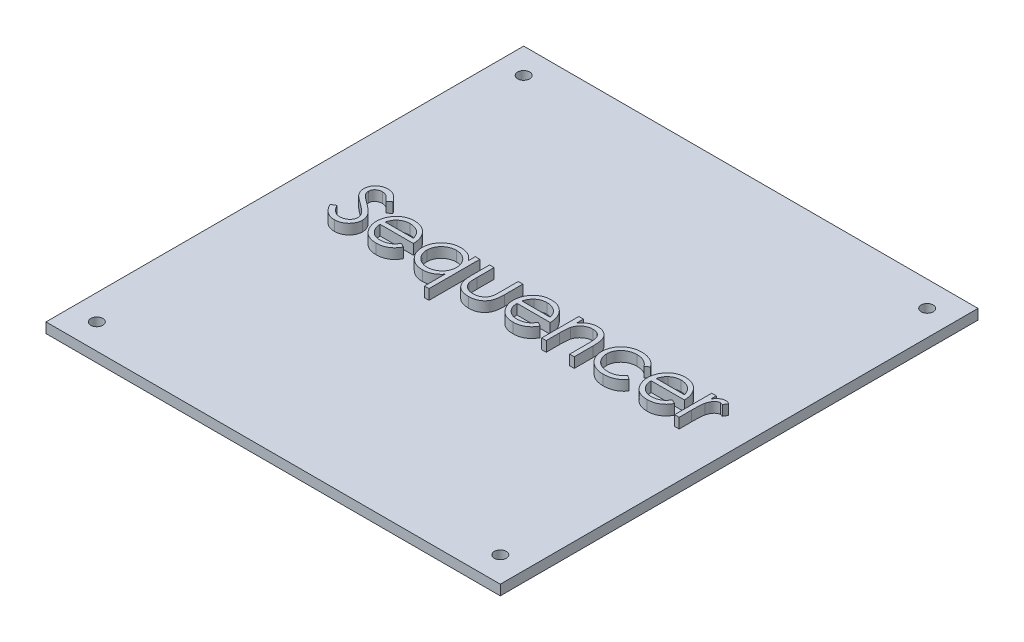
from build123d import *

# Parameters (mm, degrees)
SKETCH1_W             = 113.538
SKETCH1_H             = 119.38
BOSS_EXTRUDE1_DEPTH   = 2.54
BOSS_EXTRUDE2_DEPTH   = 2.54
F_3_0MM_DOWEL_HOLE1_D = 3


with BuildPart() as part:
    # Sketch1 → Boss-Extrude1 (new body)
    with BuildSketch(Plane(origin=(0, 0, 0), x_dir=(1, 0, 0), z_dir=(0, 1, 0))):
        Rectangle(SKETCH1_W, SKETCH1_H)
    extrude(amount=BOSS_EXTRUDE1_DEPTH)

    # Sketch2 → Boss-Extrude2 (add)
    # profile 1 of 9: a face of its own
    with BuildSketch(Plane(origin=(0, 2.54, 0), x_dir=(1, 0, 0), z_dir=(0, 1, 0))):
        with BuildLine():
            Line((-44.178603437, -1.309750689), (-43.105005681, -0.66610085))
            add(Edge.make_bspline(
                [(-43.105005681, -0.66610085), (-43.005153791, -0.833248761), (-42.813841425, -1.153497708), (-42.494703636, -1.586234026), (-42.164021358, -1.954033852), (-41.819345776, -2.254757542), (-41.462780765, -2.491517788), (-41.091998627, -2.659165886), (-40.708248856, -2.763726711), (-40.447086704, -2.776427025), (-40.316704399, -2.782767516)],
                knots=[0, 0, 0, 0, 1.272034388, 2.437168799, 3.508375237, 4.49857839, 5.41946034, 6.295179144, 7.148887113, 8, 8, 8, 8], degree=3))
            add(Edge.make_bspline(
                [(-40.316704399, -2.782767516), (-40.205354934, -2.779666276), (-39.984604357, -2.77351806), (-39.659621361, -2.714442007), (-39.344001679, -2.62368371), (-39.044250336, -2.493704902), (-38.764503392, -2.336448111), (-38.519187669, -2.146506267), (-38.307111772, -1.933849463), (-38.133632985, -1.69660383), (-38.000536857, -1.441453034), (-37.898239923, -1.179557439), (-37.841470656, -0.90680292), (-37.832919008, -0.723159241), (-37.828603437, -0.630483862)],
                knots=[0, 0, 0, 0, 1.095163259, 2.171163733, 3.241058638, 4.321873601, 5.38011039, 6.391990106, 7.366004449, 8.327778327, 9.272591725, 10.192022065, 11.087607919, 12, 12, 12, 12], degree=3))
            add(Edge.make_bspline(
                [(-37.828603437, -0.630483862), (-37.833953079, -0.524744208), (-37.844828119, -0.309790941), (-37.936745204, 0.007344942), (-38.081341042, 0.321189411), (-38.214736921, 0.515322574), (-38.283992059, 0.616110689)],
                knots=[0, 0, 0, 0, 0.938893495, 1.908633276, 2.914225137, 4, 4, 4, 4], degree=3))
            add(Edge.make_bspline(
                [(-38.283992059, 0.616110689), (-38.340854002, 0.68885202), (-38.460228538, 0.841563347), (-38.665451513, 1.068876058), (-38.906265699, 1.303348607), (-39.174430027, 1.553934328), (-39.479712949, 1.808978619), (-39.812552787, 2.080643513), (-40.181447361, 2.358597807), (-40.440162677, 2.54500683), (-40.573655521, 2.641190817)],
                knots=[0, 0, 0, 0, 0.722233717, 1.516239348, 2.393582979, 3.351407094, 4.387010283, 5.505090956, 6.712668013, 8, 8, 8, 8], degree=3))
            add(Edge.make_bspline(
                [(-40.573655521, 2.641190817), (-40.707274021, 2.736363121), (-40.962742419, 2.918325318), (-41.320006418, 3.188379149), (-41.639482041, 3.43528119), (-41.919749329, 3.661355748), (-42.160685009, 3.866633485), (-42.364187672, 4.04914315), (-42.525073293, 4.213820642), (-42.614537829, 4.320650654), (-42.6547052, 4.368614695)],
                knots=[0, 0, 0, 0, 1.452282411, 2.77665338, 3.964542531, 5.026858415, 5.96415736, 6.766646006, 7.446254459, 8, 8, 8, 8], degree=3))
            add(Edge.make_bspline(
                [(-42.6547052, 4.368614695), (-42.710848436, 4.443367029), (-42.821261643, 4.590377526), (-42.967006863, 4.820156295), (-43.090883254, 5.055372144), (-43.187992287, 5.296657138), (-43.269766567, 5.54062388), (-43.324768202, 5.790455543), (-43.359208413, 6.045031102), (-43.362735336, 6.216348661), (-43.364500873, 6.302108285)],
                knots=[0, 0, 0, 0, 1.068054152, 2.10047183, 3.106115577, 4.101338837, 5.06977816, 6.043150881, 7.020423561, 8, 8, 8, 8], degree=3))
            add(Edge.make_bspline(
                [(-43.364500873, 6.302108285), (-43.359764829, 6.436473467), (-43.350393971, 6.70233187), (-43.271144094, 7.090700883), (-43.146056737, 7.461491597), (-42.970815286, 7.811033094), (-42.744910034, 8.130223939), (-42.48348607, 8.422735734), (-42.172112963, 8.668638875), (-41.830473444, 8.883494059), (-41.456526037, 9.051663559), (-41.064673331, 9.178521972), (-40.654292526, 9.250401279), (-40.376332581, 9.260716454), (-40.235294142, 9.265950433)],
                knots=[0, 0, 0, 0, 1.005424448, 1.989358655, 2.955360095, 3.929531133, 4.905563448, 5.876582895, 6.856512386, 7.866279853, 8.892233794, 9.918561126, 10.94386622, 12, 12, 12, 12], degree=3))
            add(Edge.make_bspline(
                [(-40.235294142, 9.265950433), (-40.085636978, 9.260788602), (-39.788016645, 9.25052337), (-39.350232349, 9.16126947), (-38.928734892, 9.013584176), (-38.589669331, 8.845985331), (-38.324301882, 8.678594194), (-38.121926538, 8.52612226), (-37.916848931, 8.350589723), (-37.707414846, 8.15152903), (-37.497173025, 7.927113676), (-37.283002212, 7.678880605), (-37.06440158, 7.408346817), (-36.923773173, 7.215217914), (-36.85168036, 7.116210849)],
                knots=[0, 0, 0, 0, 1.286793592, 2.559021753, 3.825965368, 5.121522368, 5.803751409, 6.523245864, 7.299691795, 8.125521123, 9.008227632, 9.944561021, 10.946284179, 12, 12, 12, 12], degree=3))
            Line((-36.85168036, 7.116210849), (-37.882028918, 6.335181202))
            add(Edge.make_bspline(
                [(-37.882028918, 6.335181202), (-37.944244159, 6.415331593), (-38.064056166, 6.569682506), (-38.24595459, 6.78584128), (-38.417399683, 6.983295362), (-38.586311134, 7.154800256), (-38.743768025, 7.309747997), (-38.896592722, 7.442407686), (-39.042585939, 7.554079132), (-39.226615872, 7.673254335), (-39.457820164, 7.791387934), (-39.748049767, 7.891351731), (-40.051348536, 7.951422956), (-40.257921771, 7.959365491), (-40.362497668, 7.96338633)],
                knots=[0, 0, 0, 0, 1.181633172, 2.275549214, 3.290209073, 4.226197932, 5.078386478, 5.862611352, 6.581680152, 7.217281963, 8.414376989, 9.595101626, 10.782541182, 12, 12, 12, 12], degree=3))
            add(Edge.make_bspline(
                [(-40.362497668, 7.96338633), (-40.493694192, 7.95898959), (-40.74669433, 7.950510892), (-41.105887472, 7.857909802), (-41.429171143, 7.712107052), (-41.706947594, 7.507764131), (-41.938221768, 7.265662244), (-42.105518718, 6.987064684), (-42.206212172, 6.67942568), (-42.21849953, 6.464825956), (-42.224757283, 6.355533766)],
                knots=[0, 0, 0, 0, 1.14458467, 2.207223713, 3.21896685, 4.227309161, 5.202851033, 6.127160689, 7.046193047, 8, 8, 8, 8], degree=3))
            add(Edge.make_bspline(
                [(-42.224757283, 6.355533766), (-42.223330795, 6.287492687), (-42.220475487, 6.151299267), (-42.180652649, 5.950089822), (-42.129492227, 5.749388676), (-42.048420392, 5.550098161), (-41.936496004, 5.348732916), (-41.78952008, 5.141825468), (-41.604414634, 4.927552125), (-41.462620903, 4.788188226), (-41.387758085, 4.714608285)],
                knots=[0, 0, 0, 0, 0.858281714, 1.717966888, 2.583508476, 3.4729293, 4.427298488, 5.488583878, 6.674047936, 8, 8, 8, 8], degree=3))
            add(Edge.make_bspline(
                [(-41.387758085, 4.714608285), (-41.359958248, 4.689799649), (-41.293912198, 4.630860007), (-41.173168125, 4.534368017), (-41.013718543, 4.415340815), (-40.819727127, 4.268066838), (-40.587616986, 4.09722839), (-40.317362597, 3.905009854), (-40.011976463, 3.685171189), (-39.795271225, 3.531473827), (-39.680686771, 3.45020524)],
                knots=[0, 0, 0, 0, 0.420754252, 0.999615792, 1.744751191, 2.668019286, 3.750313428, 4.999500688, 6.413464383, 8, 8, 8, 8], degree=3))
            add(Edge.make_bspline(
                [(-39.680686771, 3.45020524), (-39.542852171, 3.349906593), (-39.275954572, 3.155692163), (-38.896197068, 2.863898124), (-38.551868107, 2.578519078), (-38.241758768, 2.301377475), (-37.962805415, 2.034575538), (-37.718102828, 1.774903426), (-37.505157645, 1.524221491), (-37.275907338, 1.202829573), (-37.041654679, 0.808109639), (-36.840481209, 0.324500031), (-36.713632348, -0.160989475), (-36.697044278, -0.487295425), (-36.688859848, -0.648292356)],
                knots=[0, 0, 0, 0, 1.163667725, 2.253281268, 3.268753668, 4.215851969, 5.092017293, 5.902905408, 6.650798638, 7.335211899, 8.59617414, 9.77448103, 10.901945474, 12, 12, 12, 12], degree=3))
            add(Edge.make_bspline(
                [(-36.688859848, -0.648292356), (-36.69124432, -0.762150995), (-36.695966961, -0.987657215), (-36.750253705, -1.31878278), (-36.829790776, -1.640386221), (-36.949668739, -1.948492258), (-37.095984199, -2.24873754), (-37.281644584, -2.533246207), (-37.496846754, -2.808315139), (-37.74371213, -3.066609522), (-38.013844404, -3.303722862), (-38.29935381, -3.514648313), (-38.600707658, -3.690519087), (-38.91627115, -3.834032142), (-39.246116771, -3.94627662), (-39.590133587, -4.027603317), (-39.948888671, -4.077516896), (-40.192730418, -4.082697631), (-40.316704399, -4.085331619)],
                knots=[0, 0, 0, 0, 0.983748083, 1.948392443, 2.894712957, 3.844097841, 4.80183111, 5.778335162, 6.776009319, 7.81870978, 8.863265674, 9.881300176, 10.883814829, 11.87499822, 12.874611388, 13.892143829, 14.928324115, 16, 16, 16, 16], degree=3))
            add(Edge.make_bspline(
                [(-40.316704399, -4.085331619), (-40.412626929, -4.08347676), (-40.603263944, -4.079790402), (-40.88523835, -4.047201184), (-41.161516288, -4.001092551), (-41.428630968, -3.927889498), (-41.690023862, -3.839073038), (-41.944558113, -3.729713945), (-42.19235708, -3.5986601), (-42.434809452, -3.448818154), (-42.6712986, -3.274437195), (-42.899606383, -3.071333365), (-43.127223714, -2.845108247), (-43.347432266, -2.589618488), (-43.564686247, -2.30899173), (-43.77470219, -2.000602408), (-43.98182728, -1.666130296), (-44.111786263, -1.430762699), (-44.178603437, -1.309750689)],
                knots=[0, 0, 0, 0, 0.915332311, 1.819136955, 2.706846663, 3.586547465, 4.459518054, 5.340707479, 6.227863349, 7.133153174, 8.059268498, 9.028702269, 10.047606654, 11.120612155, 12.245963614, 13.433783089, 14.680604001, 16, 16, 16, 16], degree=3))
        make_face()
    # profile 2 of 9: a face of its own
    with BuildSketch(Plane(origin=(0, 2.54, 0), x_dir=(1, 0, 0), z_dir=(0, 1, 0))):
        with BuildLine():
            Line((-26.792425553, -0.828921362), (-25.779885489, -1.3606321))
            add(Edge.make_bspline(
                [(-25.779885489, -1.3606321), (-25.860572563, -1.503755044), (-26.017557656, -1.782215618), (-26.287526084, -2.164782654), (-26.570525891, -2.508944366), (-26.879331717, -2.805506254), (-27.204704552, -3.064046994), (-27.548448757, -3.290244244), (-27.912353896, -3.482988589), (-28.296437183, -3.645376333), (-28.703924125, -3.77023364), (-29.135802199, -3.858423242), (-29.592898768, -3.912936245), (-29.906212049, -3.919268613), (-30.066644303, -3.922511106)],
                knots=[0, 0, 0, 0, 1.120438281, 2.179929193, 3.190490725, 4.156257408, 5.095198341, 6.022838206, 6.959905092, 7.901321166, 8.864066838, 9.862729781, 10.905609505, 12, 12, 12, 12], degree=3))
            add(Edge.make_bspline(
                [(-30.066644303, -3.922511106), (-30.244959478, -3.918348498), (-30.592800728, -3.910228457), (-31.099130667, -3.840224372), (-31.575850271, -3.72602467), (-32.022932738, -3.566492562), (-32.439283197, -3.358113415), (-32.825729156, -3.104260438), (-33.184302864, -2.806237685), (-33.503704995, -2.461463733), (-33.791247083, -2.092503488), (-34.044977916, -1.708034993), (-34.25709488, -1.309025579), (-34.429642922, -0.898015391), (-34.568997718, -0.477594978), (-34.666122615, -0.043939081), (-34.722110557, 0.40177861), (-34.730690117, 0.703303229), (-34.735013694, 0.855253317)],
                knots=[0, 0, 0, 0, 1.145258523, 2.234067595, 3.276747158, 4.290159414, 5.277019952, 6.260822364, 7.254936242, 8.264827045, 9.274100331, 10.257902744, 11.220704747, 12.172965371, 13.118907548, 14.062713208, 15.023725156, 16, 16, 16, 16], degree=3))
            add(Edge.make_bspline(
                [(-34.735013694, 0.855253317), (-34.731170524, 0.997837416), (-34.723553868, 1.280420271), (-34.675545011, 1.698669532), (-34.590461205, 2.105172774), (-34.473707115, 2.500267771), (-34.322935451, 2.883293), (-34.138487112, 3.254481574), (-33.92007477, 3.61343851), (-33.751445354, 3.839872738), (-33.666504078, 3.953931202)],
                knots=[0, 0, 0, 0, 1.024358464, 2.0301432, 3.019427413, 4.004406732, 4.986367066, 5.972626655, 6.978780325, 8, 8, 8, 8], degree=3))
            add(Edge.make_bspline(
                [(-33.666504078, 3.953931202), (-33.551450487, 4.091341102), (-33.324987909, 4.361808105), (-32.941969134, 4.717184316), (-32.527222707, 5.014886014), (-32.085946235, 5.261654765), (-31.613011029, 5.449156284), (-31.114774459, 5.588883797), (-30.585563332, 5.667181151), (-30.223775816, 5.678240433), (-30.038659527, 5.68389915)],
                knots=[0, 0, 0, 0, 1.030682036, 2.02871468, 2.997146059, 3.962720338, 4.930598197, 5.918074684, 6.934738563, 8, 8, 8, 8], degree=3))
            add(Edge.make_bspline(
                [(-30.038659527, 5.68389915), (-29.848349645, 5.678985887), (-29.475005038, 5.669347185), (-28.93060277, 5.579988775), (-28.41548817, 5.438283792), (-27.929867369, 5.238154323), (-27.473691132, 4.979946807), (-27.049924609, 4.660117839), (-26.651320549, 4.288486494), (-26.419423706, 4.002688563), (-26.301419944, 3.857256522)],
                knots=[0, 0, 0, 0, 1.056321875, 2.072262726, 3.055038591, 4.01806755, 4.982017516, 5.957941055, 6.960871419, 8, 8, 8, 8], degree=3))
            add(Edge.make_bspline(
                [(-26.301419944, 3.857256522), (-26.221130768, 3.74766067), (-26.061086844, 3.529198468), (-25.860618795, 3.172977412), (-25.686601962, 2.800284684), (-25.547508075, 2.405095892), (-25.434879028, 1.992093415), (-25.353392857, 1.558324753), (-25.305605955, 1.103919074), (-25.296212682, 0.794305573), (-25.29142395, 0.636463253)],
                knots=[0, 0, 0, 0, 0.94817472, 1.890038105, 2.849395472, 3.817997239, 4.812318967, 5.836947057, 6.897266129, 8, 8, 8, 8], degree=3))
            Line((-25.29142395, 0.636463253), (-33.595270104, 0.636463253))
            add(Edge.make_bspline(
                [(-33.595270104, 0.636463253), (-33.589683532, 0.514178711), (-33.578697764, 0.273711092), (-33.527479959, -0.078154321), (-33.446748694, -0.413337591), (-33.333286666, -0.729324629), (-33.195884114, -1.03024252), (-33.027570227, -1.313859054), (-32.826766703, -1.578882401), (-32.602790593, -1.827683157), (-32.35348199, -2.04924649), (-32.091198879, -2.247554364), (-31.812185086, -2.413763244), (-31.518640612, -2.548673129), (-31.211040134, -2.654287476), (-30.88928674, -2.726379283), (-30.554013575, -2.774665071), (-30.32546534, -2.780034141), (-30.209112251, -2.782767516)],
                knots=[0, 0, 0, 0, 1.094153842, 2.151609401, 3.174256925, 4.172055639, 5.149267565, 6.128595816, 7.11444997, 8.118368179, 9.117203808, 10.09244225, 11.054858984, 12.015122123, 12.976791628, 13.957293641, 14.960065497, 16, 16, 16, 16], degree=3))
            add(Edge.make_bspline(
                [(-30.209112251, -2.782767516), (-30.095352373, -2.780561139), (-29.869630952, -2.776183264), (-29.533476984, -2.733613187), (-29.202770698, -2.664778187), (-28.878880845, -2.570834509), (-28.568380918, -2.456255645), (-28.280832779, -2.317996705), (-28.016381711, -2.165053338), (-27.769214433, -1.990121089), (-27.529471114, -1.776005667), (-27.29164552, -1.508813194), (-27.036641664, -1.192809879), (-26.877022284, -0.954972748), (-26.792425553, -0.828921362)],
                knots=[0, 0, 0, 0, 0.99110716, 1.966546729, 2.947904876, 3.932708344, 4.903319531, 5.828989031, 6.710028674, 7.56322171, 8.463672341, 9.504779593, 10.677557249, 12, 12, 12, 12], degree=3))
        make_face()
        with BuildLine():
            add(Edge.make_bspline(
                [(-26.43116754, 1.776206843), (-26.472883863, 1.927383556), (-26.553174357, 2.218350065), (-26.720946308, 2.621269867), (-26.909891613, 2.979365965), (-27.133490467, 3.289897777), (-27.3868327, 3.565681952), (-27.679459505, 3.806686533), (-28.007612605, 4.022286998), (-28.369595772, 4.204268925), (-28.752924535, 4.359172126), (-29.154267003, 4.463040404), (-29.563779548, 4.534195029), (-29.840763958, 4.540821193), (-29.980145905, 4.544155561)],
                knots=[0, 0, 0, 0, 1.154881502, 2.222775134, 3.210006277, 4.132804581, 5.035138423, 5.962687519, 6.919655026, 7.923214229, 8.944639381, 9.960483929, 10.97369054, 12, 12, 12, 12], degree=3))
            add(Edge.make_bspline(
                [(-29.980145905, 4.544155561), (-30.093899582, 4.541936067), (-30.318766686, 4.537548594), (-30.650059133, 4.49592841), (-30.968211184, 4.427131259), (-31.27557037, 4.332915559), (-31.56810895, 4.207335773), (-31.851844251, 4.060076637), (-32.119561689, 3.880311461), (-32.286988676, 3.743300759), (-32.371572187, 3.674083445)],
                knots=[0, 0, 0, 0, 1.04873581, 2.073130211, 3.073294108, 4.04793562, 5.032784715, 6.005352987, 6.992311501, 8, 8, 8, 8], degree=3))
            add(Edge.make_bspline(
                [(-32.371572187, 3.674083445), (-32.432144953, 3.619312643), (-32.554729469, 3.508469888), (-32.718525075, 3.317501052), (-32.875353648, 3.111573955), (-33.018078616, 2.882810218), (-33.148988716, 2.633814819), (-33.271489204, 2.366687972), (-33.381748471, 2.079402613), (-33.443782928, 1.879205477), (-33.47569879, 1.776206843)],
                knots=[0, 0, 0, 0, 0.879870761, 1.780643979, 2.707998968, 3.669668524, 4.684282772, 5.740141944, 6.837334558, 8, 8, 8, 8], degree=3))
            Line((-33.47569879, 1.776206843), (-26.43116754, 1.776206843))
        make_face(mode=Mode.SUBTRACT)
    # profile 3 of 9: a face of its own
    with BuildSketch(Plane(origin=(0, 2.54, 0), x_dir=(1, 0, 0), z_dir=(0, 1, 0))):
        with BuildLine():
            Line((-13.568347027, 5.521078638), (-13.568347027, -7.178921362))
            Line((-13.568347027, -7.178921362), (-14.708090617, -7.178921362))
            Line((-14.708090617, -7.178921362), (-14.708090617, -2.078059984))
            add(Edge.make_bspline(
                [(-14.708090617, -2.078059984), (-14.8367963, -2.223998468), (-15.08869527, -2.509624966), (-15.507323907, -2.887075713), (-15.950292386, -3.206036616), (-16.417264266, -3.467597609), (-16.904679265, -3.674001887), (-17.417363012, -3.814460012), (-17.950015143, -3.908537958), (-18.314323255, -3.917814712), (-18.498755681, -3.922511106)],
                knots=[0, 0, 0, 0, 1.069893489, 2.093963999, 3.093541679, 4.066938296, 5.033073547, 5.99758523, 6.986269586, 8, 8, 8, 8], degree=3))
            add(Edge.make_bspline(
                [(-18.498755681, -3.922511106), (-18.662650828, -3.918061127), (-18.985859314, -3.90928557), (-19.46130768, -3.841205211), (-19.918842413, -3.731874099), (-20.358895863, -3.579833728), (-20.778620505, -3.378154747), (-21.181609998, -3.136705075), (-21.565776624, -2.849174063), (-21.925264779, -2.520468932), (-22.256306609, -2.163435693), (-22.546814656, -1.78263328), (-22.789032974, -1.379708348), (-22.991580124, -0.959762333), (-23.147595431, -0.519562482), (-23.256356904, -0.060631044), (-23.324357953, 0.416489354), (-23.333129882, 0.741389909), (-23.337577796, 0.906134727)],
                knots=[0, 0, 0, 0, 1.033919861, 2.038935746, 3.024066025, 3.998881131, 4.97069526, 5.957263378, 6.95902576, 7.993208707, 9.027059324, 10.027763471, 11.009749337, 11.988697705, 12.965288445, 13.950418724, 14.960734635, 16, 16, 16, 16], degree=3))
            add(Edge.make_bspline(
                [(-23.337577796, 0.906134727), (-23.3330313, 1.067474452), (-23.324043122, 1.386434383), (-23.257084296, 1.855531373), (-23.144486065, 2.307354776), (-22.986469589, 2.74044997), (-22.783843067, 3.155341009), (-22.537361151, 3.552321329), (-22.247006041, 3.932484571), (-21.912261593, 4.286891594), (-21.549641141, 4.614263537), (-21.161715175, 4.898776359), (-20.758133554, 5.144491782), (-20.332636344, 5.339177253), (-19.891521421, 5.49669029), (-19.430861775, 5.60566706), (-18.952574047, 5.669883054), (-18.627851404, 5.679182227), (-18.463138694, 5.68389915)],
                knots=[0, 0, 0, 0, 1.020392517, 2.01726096, 2.990465484, 3.961182959, 4.928053699, 5.906110375, 6.912531644, 7.948652711, 8.985773172, 9.998621852, 10.987621588, 11.969261332, 12.953316658, 13.946091881, 14.958173133, 16, 16, 16, 16], degree=3))
            add(Edge.make_bspline(
                [(-18.463138694, 5.68389915), (-18.273727777, 5.678682166), (-17.902301907, 5.668451907), (-17.359003131, 5.583315725), (-16.845036025, 5.439484715), (-16.356433091, 5.243841222), (-15.894948887, 4.983858691), (-15.464952344, 4.655908547), (-15.061943305, 4.262059097), (-14.828334818, 3.959543484), (-14.708090617, 3.803831041)],
                knots=[0, 0, 0, 0, 1.038897134, 2.037228247, 3.008116434, 3.962042015, 4.918381754, 5.904844433, 6.921570401, 8, 8, 8, 8], degree=3))
            Line((-14.708090617, 3.803831041), (-14.708090617, 5.521078638))
            Line((-14.708090617, 5.521078638), (-13.568347027, 5.521078638))
        make_face()
        with BuildLine():
            add(Edge.make_bspline(
                [(-18.447874271, 4.544155561), (-18.614477725, 4.53822779), (-18.943326445, 4.526527312), (-19.42608611, 4.435183487), (-19.888051927, 4.283202244), (-20.326913396, 4.075350774), (-20.735738068, 3.813989359), (-21.101112245, 3.497863196), (-21.426024333, 3.135597459), (-21.699285749, 2.728826944), (-21.922045552, 2.292752157), (-22.07868021, 1.83691491), (-22.181982908, 1.369536849), (-22.192536683, 1.052535103), (-22.197834207, 0.893414375)],
                knots=[0, 0, 0, 0, 1.031046209, 2.035121221, 3.029706178, 4.034933723, 5.034054252, 6.02443088, 7.017295772, 8.038157696, 9.050218397, 10.03989886, 11.016116709, 12, 12, 12, 12], degree=3))
            add(Edge.make_bspline(
                [(-22.197834207, 0.893414375), (-22.191067308, 0.735244557), (-22.177560035, 0.419524895), (-22.080493229, -0.048490341), (-21.917643403, -0.504435008), (-21.695422204, -0.944439184), (-21.417159308, -1.352958634), (-21.094620483, -1.722129936), (-20.724686606, -2.039592157), (-20.31492108, -2.305339924), (-19.877286444, -2.520015357), (-19.417060464, -2.66938782), (-18.942894577, -2.765827195), (-18.620487537, -2.777092011), (-18.458050553, -2.782767516)],
                knots=[0, 0, 0, 0, 0.979072187, 1.954306742, 2.945804271, 3.96968567, 4.997920485, 5.998718438, 6.996577872, 8.005894225, 9.015743152, 10.005417472, 10.995077863, 12, 12, 12, 12], degree=3))
            add(Edge.make_bspline(
                [(-18.458050553, -2.782767516), (-18.293144671, -2.776744219), (-17.965163229, -2.764764477), (-17.480971346, -2.6730296), (-17.011089624, -2.521468532), (-16.561918824, -2.311377415), (-16.143486005, -2.051000723), (-15.767936563, -1.746174993), (-15.450378621, -1.391652011), (-15.181165437, -1.002028881), (-14.970071783, -0.574902494), (-14.816307225, -0.12011843), (-14.725397338, 0.362339142), (-14.713939291, 0.692045391), (-14.708090617, 0.860341458)],
                knots=[0, 0, 0, 0, 1.01762866, 2.023962475, 3.030623092, 4.058876274, 5.077231937, 6.066672613, 7.034107872, 8.005628644, 8.981990164, 9.965428785, 10.961468474, 12, 12, 12, 12], degree=3))
            add(Edge.make_bspline(
                [(-14.708090617, 0.860341458), (-14.711572798, 0.9885673), (-14.718426834, 1.240956336), (-14.770789186, 1.611533328), (-14.854082776, 1.966167134), (-14.971453165, 2.305230605), (-15.125635825, 2.62684909), (-15.311592004, 2.933331877), (-15.532591779, 3.223084958), (-15.785077562, 3.492118387), (-16.06144844, 3.737505836), (-16.353891487, 3.956541795), (-16.665871512, 4.136478199), (-16.992141903, 4.285399384), (-17.333268745, 4.403905443), (-17.692027852, 4.482963646), (-18.06460589, 4.537248239), (-18.318773005, 4.541828878), (-18.447874271, 4.544155561)],
                knots=[0, 0, 0, 0, 1.050140795, 2.067009409, 3.05949893, 4.030605086, 5.00011959, 5.97591094, 6.962425594, 7.979863591, 8.993523472, 9.986985069, 10.967611495, 11.937549037, 12.921786183, 13.919465291, 14.943216303, 16, 16, 16, 16], degree=3))
        make_face(mode=Mode.SUBTRACT)
    # profile 4 of 9: a face of its own
    with BuildSketch(Plane(origin=(0, 2.54, 0), x_dir=(1, 0, 0), z_dir=(0, 1, 0))):
        with BuildLine():
            Line((-11.126039335, 5.521078638), (-9.986295745, 5.521078638))
            Line((-9.986295745, 5.521078638), (-9.986295745, 1.21651133))
            add(Edge.make_bspline(
                [(-9.986295745, 1.21651133), (-9.985780833, 1.090154497), (-9.98479583, 0.848439795), (-9.978115845, 0.500622403), (-9.962403791, 0.183424617), (-9.942759342, -0.103336799), (-9.917496733, -0.359613334), (-9.887439968, -0.584509858), (-9.853845124, -0.780576755), (-9.820960419, -0.898662646), (-9.805666739, -0.953580817)],
                knots=[0, 0, 0, 0, 1.388932606, 2.656963016, 3.823490214, 4.879454478, 5.816252168, 6.653371382, 7.373723809, 8, 8, 8, 8], degree=3))
            add(Edge.make_bspline(
                [(-9.805666739, -0.953580817), (-9.781132316, -1.022606664), (-9.732573536, -1.159223325), (-9.644495466, -1.356577716), (-9.535535502, -1.539368026), (-9.41630127, -1.714642804), (-9.278780562, -1.877210014), (-9.124713338, -2.026795126), (-8.959256878, -2.169049972), (-8.713402936, -2.337360503), (-8.377182171, -2.517756129), (-7.935756459, -2.67340667), (-7.457132553, -2.766428074), (-7.126334858, -2.777220371), (-6.956307764, -2.782767516)],
                knots=[0, 0, 0, 0, 0.725840625, 1.436591201, 2.137033971, 2.831655856, 3.53531722, 4.242432219, 4.957935707, 5.694543706, 7.190802206, 8.724350549, 10.316345118, 12, 12, 12, 12], degree=3))
            add(Edge.make_bspline(
                [(-6.956307764, -2.782767516), (-6.786296465, -2.777102414), (-6.457356057, -2.76614149), (-5.983990883, -2.67621265), (-5.551278608, -2.52596915), (-5.163562298, -2.316210827), (-4.822600536, -2.059518199), (-4.538467359, -1.758314807), (-4.304035321, -1.422129889), (-4.201675423, -1.171307506), (-4.150197989, -1.045167356)],
                knots=[0, 0, 0, 0, 1.157059328, 2.238695713, 3.266970494, 4.264342957, 5.228770407, 6.160125903, 7.074715775, 8, 8, 8, 8], degree=3))
            add(Edge.make_bspline(
                [(-4.150197989, -1.045167356), (-4.134978925, -0.994489644), (-4.101333293, -0.882453599), (-4.065184189, -0.69238994), (-4.032619714, -0.465732661), (-4.004813332, -0.200998589), (-3.984982599, 0.10112045), (-3.974292731, 0.44053004), (-3.962215847, 0.81616469), (-3.962032545, 1.079119131), (-3.961936771, 1.21651133)],
                knots=[0, 0, 0, 0, 0.557542046, 1.232589297, 2.036731608, 2.971723315, 4.038036528, 5.22795436, 6.551621927, 8, 8, 8, 8], degree=3))
            Line((-3.961936771, 1.21651133), (-3.961936771, 5.521078638))
            Line((-3.961936771, 5.521078638), (-2.822193181, 5.521078638))
            Line((-2.822193181, 5.521078638), (-2.822193181, 1.002809407))
            add(Edge.make_bspline(
                [(-2.822193181, 1.002809407), (-2.823795902, 0.849294813), (-2.8269054, 0.551455502), (-2.84688919, 0.118624583), (-2.881177784, -0.284735562), (-2.933221241, -0.658838446), (-2.994419546, -1.003398451), (-3.073363737, -1.318857183), (-3.167627628, -1.604242708), (-3.273964782, -1.86456287), (-3.399592701, -2.100590172), (-3.533222176, -2.324602992), (-3.687526348, -2.531043071), (-3.849978341, -2.730186826), (-4.030687207, -2.91212894), (-4.226266695, -3.081044295), (-4.433964018, -3.23951501), (-4.658388251, -3.38136051), (-4.896263108, -3.509146623), (-5.147882246, -3.622416392), (-5.416327582, -3.712051457), (-5.698135637, -3.78937873), (-5.994687093, -3.850028375), (-6.305696062, -3.892796775), (-6.631057784, -3.919014404), (-6.852797823, -3.921325967), (-6.966484046, -3.922511106)],
                knots=[0, 0, 0, 0, 1.493040784, 2.896703357, 4.213163133, 5.428574705, 6.569057535, 7.615249723, 8.588095153, 9.490268104, 10.346124644, 11.18633936, 12.024365274, 12.850166724, 13.684164916, 14.514361689, 15.362232829, 16.222528818, 17.093394965, 17.986930858, 18.902426812, 19.842810585, 20.827885679, 21.843828298, 22.894529745, 24, 24, 24, 24], degree=3))
            add(Edge.make_bspline(
                [(-6.966484046, -3.922511106), (-7.079319969, -3.921278454), (-7.301053061, -3.918856179), (-7.626431576, -3.89294162), (-7.938302233, -3.850094829), (-8.23555625, -3.788934469), (-8.518491921, -3.712592701), (-8.788255305, -3.621865586), (-9.041687663, -3.509087838), (-9.281833791, -3.382169273), (-9.506813886, -3.238603845), (-9.717665012, -3.081239815), (-9.914104448, -2.910312101), (-10.096175524, -2.726534548), (-10.26132261, -2.527627378), (-10.411603676, -2.315190631), (-10.549332292, -2.091329224), (-10.673983845, -1.85161432), (-10.781069358, -1.588281599), (-10.875612679, -1.296917847), (-10.952939852, -0.974328714), (-11.015868238, -0.620790002), (-11.066492036, -0.237993709), (-11.101638895, 0.176274541), (-11.121290624, 0.621005653), (-11.124422304, 0.928163825), (-11.126039335, 1.086763734)],
                knots=[0, 0, 0, 0, 1.083640291, 2.129454052, 3.13281866, 4.105697902, 5.042300162, 5.946461698, 6.836384745, 7.703652036, 8.553297018, 9.397182691, 10.228592656, 11.052265423, 11.879314572, 12.708807002, 13.549817954, 14.402308542, 15.300838682, 16.27712199, 17.341985831, 18.484375296, 19.725102775, 21.0496083, 22.476576903, 24, 24, 24, 24], degree=3))
            Line((-11.126039335, 1.086763734), (-11.126039335, 5.521078638))
        make_face()
    # profile 5 of 9: a face of its own
    with BuildSketch(Plane(origin=(0, 2.54, 0), x_dir=(1, 0, 0), z_dir=(0, 1, 0))):
        with BuildLine():
            Line((7.39988214, -0.828921362), (8.412422204, -1.3606321))
            add(Edge.make_bspline(
                [(8.412422204, -1.3606321), (8.33173513, -1.503755044), (8.174750036, -1.782215618), (7.904781608, -2.164782654), (7.621781802, -2.508944366), (7.312975975, -2.805506254), (6.98760314, -3.064046994), (6.643858935, -3.290244244), (6.279953797, -3.482988589), (5.89587051, -3.645376333), (5.488383567, -3.77023364), (5.056505493, -3.858423242), (4.599408924, -3.912936245), (4.286095643, -3.919268613), (4.12566339, -3.922511106)],
                knots=[0, 0, 0, 0, 1.120438281, 2.179929193, 3.190490725, 4.156257408, 5.095198341, 6.022838206, 6.959905092, 7.901321166, 8.864066838, 9.862729781, 10.905609505, 12, 12, 12, 12], degree=3))
            add(Edge.make_bspline(
                [(4.12566339, -3.922511106), (3.947348214, -3.918348498), (3.599506965, -3.910228457), (3.093177025, -3.840224372), (2.616457421, -3.72602467), (2.169374955, -3.566492562), (1.753024495, -3.358113415), (1.366578536, -3.104260438), (1.008004828, -2.806237685), (0.688602698, -2.461463733), (0.401060609, -2.092503488), (0.147329777, -1.708034993), (-0.064787187, -1.309025579), (-0.23733523, -0.898015391), (-0.376690026, -0.477594978), (-0.473814922, -0.043939081), (-0.529802865, 0.40177861), (-0.538382425, 0.703303229), (-0.542706001, 0.855253317)],
                knots=[0, 0, 0, 0, 1.145258523, 2.234067595, 3.276747158, 4.290159414, 5.277019952, 6.260822364, 7.254936242, 8.264827045, 9.274100331, 10.257902744, 11.220704747, 12.172965371, 13.118907548, 14.062713208, 15.023725156, 16, 16, 16, 16], degree=3))
            add(Edge.make_bspline(
                [(-0.542706001, 0.855253317), (-0.538862831, 0.997837416), (-0.531246176, 1.280420271), (-0.483237319, 1.698669532), (-0.398153513, 2.105172774), (-0.281399423, 2.500267771), (-0.130627758, 2.883293), (0.05382058, 3.254481574), (0.272232922, 3.61343851), (0.440862339, 3.839872738), (0.525803614, 3.953931202)],
                knots=[0, 0, 0, 0, 1.024358464, 2.0301432, 3.019427413, 4.004406732, 4.986367066, 5.972626655, 6.978780325, 8, 8, 8, 8], degree=3))
            add(Edge.make_bspline(
                [(0.525803614, 3.953931202), (0.640857206, 4.091341102), (0.867319783, 4.361808105), (1.250338559, 4.717184316), (1.665084985, 5.014886014), (2.106361457, 5.261654765), (2.579296663, 5.449156284), (3.077533233, 5.588883797), (3.606744361, 5.667181151), (3.968531876, 5.678240433), (4.153648165, 5.68389915)],
                knots=[0, 0, 0, 0, 1.030682036, 2.02871468, 2.997146059, 3.962720338, 4.930598197, 5.918074684, 6.934738563, 8, 8, 8, 8], degree=3))
            add(Edge.make_bspline(
                [(4.153648165, 5.68389915), (4.343958047, 5.678985887), (4.717302654, 5.669347185), (5.261704922, 5.579988775), (5.776819522, 5.438283792), (6.262440323, 5.238154323), (6.718616561, 4.979946807), (7.142383084, 4.660117839), (7.540987143, 4.288486494), (7.772883987, 4.002688563), (7.890887749, 3.857256522)],
                knots=[0, 0, 0, 0, 1.056321875, 2.072262726, 3.055038591, 4.01806755, 4.982017516, 5.957941055, 6.960871419, 8, 8, 8, 8], degree=3))
            add(Edge.make_bspline(
                [(7.890887749, 3.857256522), (7.971176925, 3.74766067), (8.131220848, 3.529198468), (8.331688897, 3.172977412), (8.50570573, 2.800284684), (8.644799617, 2.405095892), (8.757428665, 1.992093415), (8.838914835, 1.558324753), (8.886701737, 1.103919074), (8.89609501, 0.794305573), (8.900883742, 0.636463253)],
                knots=[0, 0, 0, 0, 0.94817472, 1.890038105, 2.849395472, 3.817997239, 4.812318967, 5.836947057, 6.897266129, 8, 8, 8, 8], degree=3))
            Line((8.900883742, 0.636463253), (0.597037588, 0.636463253))
            add(Edge.make_bspline(
                [(0.597037588, 0.636463253), (0.60262416, 0.514178711), (0.613609929, 0.273711092), (0.664827734, -0.078154321), (0.745558999, -0.413337591), (0.859021026, -0.729324629), (0.996423579, -1.03024252), (1.164737465, -1.313859054), (1.36554099, -1.578882401), (1.589517099, -1.827683157), (1.838825702, -2.04924649), (2.101108813, -2.247554364), (2.380122606, -2.413763244), (2.673667081, -2.548673129), (2.981267558, -2.654287476), (3.303020952, -2.726379283), (3.638294117, -2.774665071), (3.866842352, -2.780034141), (3.983195441, -2.782767516)],
                knots=[0, 0, 0, 0, 1.094153842, 2.151609401, 3.174256925, 4.172055639, 5.149267565, 6.128595816, 7.11444997, 8.118368179, 9.117203808, 10.09244225, 11.054858984, 12.015122123, 12.976791628, 13.957293641, 14.960065497, 16, 16, 16, 16], degree=3))
            add(Edge.make_bspline(
                [(3.983195441, -2.782767516), (4.096955319, -2.780561139), (4.322676741, -2.776183264), (4.658830709, -2.733613187), (4.989536994, -2.664778187), (5.313426847, -2.570834509), (5.623926774, -2.456255645), (5.911474913, -2.317996705), (6.175925981, -2.165053338), (6.42309326, -1.990121089), (6.662836579, -1.776005667), (6.900662172, -1.508813194), (7.155666029, -1.192809879), (7.315285408, -0.954972748), (7.39988214, -0.828921362)],
                knots=[0, 0, 0, 0, 0.99110716, 1.966546729, 2.947904876, 3.932708344, 4.903319531, 5.828989031, 6.710028674, 7.56322171, 8.463672341, 9.504779593, 10.677557249, 12, 12, 12, 12], degree=3))
        make_face()
        with BuildLine():
            add(Edge.make_bspline(
                [(7.761140152, 1.776206843), (7.719423829, 1.927383556), (7.639133335, 2.218350065), (7.471361384, 2.621269867), (7.282416079, 2.979365965), (7.058817225, 3.289897777), (6.805474992, 3.565681952), (6.512848187, 3.806686533), (6.184695088, 4.022286998), (5.82271192, 4.204268925), (5.439383157, 4.359172126), (5.038040689, 4.463040404), (4.628528144, 4.534195029), (4.351543734, 4.540821193), (4.212161787, 4.544155561)],
                knots=[0, 0, 0, 0, 1.154881502, 2.222775134, 3.210006277, 4.132804581, 5.035138423, 5.962687519, 6.919655026, 7.923214229, 8.944639381, 9.960483929, 10.97369054, 12, 12, 12, 12], degree=3))
            add(Edge.make_bspline(
                [(4.212161787, 4.544155561), (4.09840811, 4.541936067), (3.873541006, 4.537548594), (3.542248559, 4.49592841), (3.224096509, 4.427131259), (2.916737322, 4.332915559), (2.624198743, 4.207335773), (2.340463441, 4.060076637), (2.072746003, 3.880311461), (1.905319017, 3.743300759), (1.820735505, 3.674083445)],
                knots=[0, 0, 0, 0, 1.04873581, 2.073130211, 3.073294108, 4.04793562, 5.032784715, 6.005352987, 6.992311501, 8, 8, 8, 8], degree=3))
            add(Edge.make_bspline(
                [(1.820735505, 3.674083445), (1.760162739, 3.619312643), (1.637578223, 3.508469888), (1.473782617, 3.317501052), (1.316954045, 3.111573955), (1.174229076, 2.882810218), (1.043318977, 2.633814819), (0.920818488, 2.366687972), (0.810559221, 2.079402613), (0.748524765, 1.879205477), (0.716608902, 1.776206843)],
                knots=[0, 0, 0, 0, 0.879870761, 1.780643979, 2.707998968, 3.669668524, 4.684282772, 5.740141944, 6.837334558, 8, 8, 8, 8], degree=3))
            Line((0.716608902, 1.776206843), (7.761140152, 1.776206843))
        make_face(mode=Mode.SUBTRACT)
    # profile 6 of 9: a face of its own
    with BuildSketch(Plane(origin=(0, 2.54, 0), x_dir=(1, 0, 0), z_dir=(0, 1, 0))):
        with BuildLine():
            Line((11.180370922, 5.521078638), (12.320114511, 5.521078638))
            Line((12.320114511, 5.521078638), (12.320114511, 3.84708024))
            add(Edge.make_bspline(
                [(12.320114511, 3.84708024), (12.441808216, 3.998909549), (12.677959096, 4.293539619), (13.071239391, 4.680782847), (13.486870115, 4.999898378), (13.922305956, 5.254275001), (14.378138021, 5.446032759), (14.851587743, 5.584520566), (15.345489677, 5.667559801), (15.681366348, 5.678410066), (15.851284383, 5.68389915)],
                knots=[0, 0, 0, 0, 1.12780773, 2.188550248, 3.19190651, 4.159438251, 5.104880172, 6.052711206, 7.014878035, 8, 8, 8, 8], degree=3))
            add(Edge.make_bspline(
                [(15.851284383, 5.68389915), (16.02302697, 5.677566584), (16.359168639, 5.665172224), (16.848583318, 5.567140231), (17.305686776, 5.399698877), (17.728849164, 5.170329364), (18.110310766, 4.88510016), (18.445318085, 4.552803638), (18.722407582, 4.170584136), (18.908180871, 3.815988683), (19.030556793, 3.501432201), (19.107599846, 3.232022565), (19.17302655, 2.931873845), (19.229747464, 2.601893051), (19.26812727, 2.239768189), (19.298397871, 1.846983706), (19.32009199, 1.423666833), (19.320952713, 1.130889642), (19.321396563, 0.979912772)],
                knots=[0, 0, 0, 0, 1.235846778, 2.418850247, 3.575807741, 4.728682307, 5.871620074, 6.994088408, 8.11269785, 9.256955736, 9.865816715, 10.540099792, 11.271859618, 12.076849838, 12.949306005, 13.892391288, 14.913166135, 16, 16, 16, 16], degree=3))
            Line((19.321396563, 0.979912772), (19.321396563, -3.759690593))
            Line((19.321396563, -3.759690593), (18.181652973, -3.759690593))
            Line((18.181652973, -3.759690593), (18.181652973, 0.605934407))
            add(Edge.make_bspline(
                [(18.181652973, 0.605934407), (18.180951904, 0.732290136), (18.179610878, 0.97398714), (18.175381246, 1.320040453), (18.165185662, 1.63386318), (18.150858926, 1.914705056), (18.129889301, 2.162296406), (18.108035753, 2.377141496), (18.081311409, 2.55896755), (18.05749741, 2.668423706), (18.046817236, 2.717512933)],
                knots=[0, 0, 0, 0, 1.430800155, 2.736877192, 3.918605307, 4.986035426, 5.920637409, 6.731861385, 7.431261377, 8, 8, 8, 8], degree=3))
            add(Edge.make_bspline(
                [(18.046817236, 2.717512933), (18.008261736, 2.861607804), (17.934054327, 3.138945848), (17.75068816, 3.515135642), (17.519133847, 3.835169067), (17.236475936, 4.097067456), (16.905444719, 4.30088735), (16.526958801, 4.442307128), (16.10467059, 4.530758162), (15.807656116, 4.539565184), (15.652846883, 4.544155561)],
                knots=[0, 0, 0, 0, 1.084156227, 2.086665306, 3.027808233, 3.945421172, 4.874247719, 5.839848303, 6.874090471, 8, 8, 8, 8], degree=3))
            add(Edge.make_bspline(
                [(15.652846883, 4.544155561), (15.561161288, 4.542428344), (15.379717865, 4.539010226), (15.110659396, 4.504715516), (14.849677396, 4.448623406), (14.594152638, 4.372900064), (14.349195786, 4.268896973), (14.106936787, 4.150861829), (13.876497957, 4.003729746), (13.65296563, 3.839752348), (13.445002014, 3.658036368), (13.251496329, 3.466286288), (13.079001227, 3.26208624), (12.922723462, 3.04872643), (12.787819478, 2.823276618), (12.67006113, 2.587911849), (12.570145894, 2.342322338), (12.520497267, 2.171869973), (12.495655377, 2.086583445)],
                knots=[0, 0, 0, 0, 1.023777757, 2.026029729, 3.023749952, 4.003683103, 4.997618607, 5.993177895, 7.010360494, 8.046726602, 9.087585522, 10.09234134, 11.086953743, 12.070360549, 13.043493632, 14.017870808, 15.008233677, 16, 16, 16, 16], degree=3))
            add(Edge.make_bspline(
                [(12.495655377, 2.086583445), (12.481360081, 2.023971709), (12.450239968, 1.887669233), (12.416627859, 1.663988054), (12.386120371, 1.405234716), (12.360586264, 1.111711166), (12.344963753, 0.782389733), (12.327929799, 0.418676836), (12.321728348, 0.019122178), (12.320667521, -0.25905025), (12.320114511, -0.404061587)],
                knots=[0, 0, 0, 0, 0.615963638, 1.340920617, 2.168419149, 3.115676021, 4.16674242, 5.331190069, 6.6087489, 8, 8, 8, 8], degree=3))
            Line((12.320114511, -0.404061587), (12.320114511, -3.759690593))
            Line((12.320114511, -3.759690593), (11.180370922, -3.759690593))
            Line((11.180370922, -3.759690593), (11.180370922, 5.521078638))
        make_face()
    # profile 7 of 9: a face of its own
    with BuildSketch(Plane(origin=(0, 2.54, 0), x_dir=(1, 0, 0), z_dir=(0, 1, 0))):
        with BuildLine():
            Line((31.044473486, 3.508718862), (30.090447043, 2.915950433))
            add(Edge.make_bspline(
                [(30.090447043, 2.915950433), (29.985835818, 3.045956319), (29.779926381, 3.301850833), (29.422369723, 3.632086877), (29.041328306, 3.915721571), (28.630290818, 4.146875182), (28.189833772, 4.32547873), (27.721694169, 4.451862619), (27.225938766, 4.530618014), (26.886067901, 4.539569108), (26.711921402, 4.544155561)],
                knots=[0, 0, 0, 0, 1.026593902, 2.0206758, 2.988051866, 3.946915611, 4.916868779, 5.907761954, 6.927957743, 8, 8, 8, 8], degree=3))
            add(Edge.make_bspline(
                [(26.711921402, 4.544155561), (26.572733187, 4.540320733), (26.298605782, 4.532768145), (25.896174883, 4.48555864), (25.512844058, 4.399771925), (25.146210629, 4.286738453), (24.798882253, 4.135244544), (24.469948921, 3.950877715), (24.156493, 3.736610425), (23.867597967, 3.488377875), (23.603332713, 3.218416995), (23.374373796, 2.929025015), (23.17503121, 2.628869981), (23.018618168, 2.310456517), (22.890619692, 1.981069123), (22.806412451, 1.634490276), (22.750297699, 1.275160077), (22.743877563, 1.030164958), (22.740627332, 0.906134727)],
                knots=[0, 0, 0, 0, 1.112346261, 2.190735716, 3.231507886, 4.247384806, 5.251966152, 6.253067467, 7.256802811, 8.280671706, 9.291813951, 10.270744147, 11.225547591, 12.165006084, 13.100104208, 14.043489273, 15.009504848, 16, 16, 16, 16], degree=3))
            add(Edge.make_bspline(
                [(22.740627332, 0.906134727), (22.747083476, 0.743686447), (22.759908772, 0.420978737), (22.860425497, -0.055373232), (23.024960918, -0.515924909), (23.250142262, -0.957406435), (23.53490215, -1.36596237), (23.869356879, -1.732388047), (24.253691839, -2.04958335), (24.684520582, -2.312555083), (25.151727251, -2.523960617), (25.650257059, -2.67457294), (26.176036263, -2.765477263), (26.536015031, -2.776928828), (26.719553614, -2.782767516)],
                knots=[0, 0, 0, 0, 0.966302908, 1.919585723, 2.883856336, 3.870342332, 4.860282998, 5.839159637, 6.814385684, 7.815993281, 8.834850808, 9.858348828, 10.908058873, 12, 12, 12, 12], degree=3))
            add(Edge.make_bspline(
                [(26.719553614, -2.782767516), (26.887756712, -2.778052198), (27.218320434, -2.768785346), (27.70152744, -2.690665965), (28.161557402, -2.562781923), (28.59839397, -2.384446164), (29.011238915, -2.153932035), (29.397424779, -1.869600186), (29.764635983, -1.539630237), (29.980525013, -1.284476455), (30.090447043, -1.154562388)],
                knots=[0, 0, 0, 0, 1.039848629, 2.043578496, 3.018386758, 3.987534228, 4.954977003, 5.934852016, 6.948509513, 8, 8, 8, 8], degree=3))
            Line((30.090447043, -1.154562388), (31.044473486, -1.780403734))
            add(Edge.make_bspline(
                [(31.044473486, -1.780403734), (30.987912395, -1.863464372), (30.874977946, -2.029309958), (30.686191991, -2.263150039), (30.482557173, -2.482031572), (30.264867936, -2.685661159), (30.035966729, -2.878911686), (29.788034028, -3.052544542), (29.529064295, -3.21631947), (29.256017352, -3.363686178), (28.971716247, -3.496151973), (28.676561028, -3.610057078), (28.371834279, -3.707920034), (28.057177714, -3.785706978), (27.731970997, -3.847794878), (27.397055181, -3.888992595), (27.052545613, -3.919745758), (26.819692379, -3.921581332), (26.70174512, -3.922511106)],
                knots=[0, 0, 0, 0, 0.954134338, 1.905101784, 2.851144739, 3.791306361, 4.734911809, 5.6936923, 6.663572882, 7.643865596, 8.638447847, 9.640600242, 10.646758161, 11.676244097, 12.717260333, 13.78922464, 14.880174919, 16, 16, 16, 16], degree=3))
            add(Edge.make_bspline(
                [(26.70174512, -3.922511106), (26.521728485, -3.919277034), (26.168894574, -3.912938228), (25.652467189, -3.843238903), (25.158931882, -3.738164124), (24.688457269, -3.587347147), (24.240970105, -3.393201248), (23.816887647, -3.156049015), (23.417614096, -2.873921092), (23.047097827, -2.551839043), (22.706805151, -2.202623003), (22.414610117, -1.825796158), (22.161171564, -1.435212927), (21.957653907, -1.022246932), (21.795649346, -0.592386866), (21.684960382, -0.142189138), (21.613369619, 0.324634755), (21.605084214, 0.642979784), (21.600883742, 0.804371907)],
                knots=[0, 0, 0, 0, 1.1129367, 2.181364009, 3.217532258, 4.231199276, 5.232079859, 6.230262199, 7.231623845, 8.250719726, 9.263571943, 10.242672461, 11.195837495, 12.138959767, 13.085126421, 14.0317438, 15.002148558, 16, 16, 16, 16], degree=3))
            add(Edge.make_bspline(
                [(21.600883742, 0.804371907), (21.602484001, 0.913876512), (21.605667179, 1.131699246), (21.642177603, 1.45498706), (21.68934349, 1.773969496), (21.76926545, 2.08460322), (21.8615786, 2.391599558), (21.979418386, 2.69125824), (22.117650248, 2.984971767), (22.274593028, 3.271983529), (22.451263617, 3.547571858), (22.646775521, 3.807935156), (22.85376497, 4.056201162), (23.081915433, 4.283798808), (23.321545034, 4.49983013), (23.579433323, 4.698523896), (23.854101128, 4.880464063), (24.14142347, 5.04901489), (24.441233137, 5.199090555), (24.751717912, 5.328388304), (25.071006904, 5.43888765), (25.399610855, 5.526368586), (25.735348684, 5.599728951), (26.08086611, 5.645876564), (26.434841317, 5.678483898), (26.674530313, 5.682079058), (26.795875729, 5.68389915)],
                knots=[0, 0, 0, 0, 0.990994727, 1.971252077, 2.943264845, 3.907940874, 4.872158414, 5.844625996, 6.82015047, 7.809835459, 8.804511986, 9.781214284, 10.756496977, 11.728388426, 12.696359165, 13.676225489, 14.672885716, 15.677705647, 16.690706858, 17.706033469, 18.721040654, 19.747369689, 20.783475414, 21.830280724, 22.901553713, 24, 24, 24, 24], degree=3))
            add(Edge.make_bspline(
                [(26.795875729, 5.68389915), (26.947840693, 5.680554003), (27.251011028, 5.673880428), (27.700738735, 5.617715033), (28.143842438, 5.533037179), (28.572547642, 5.407587197), (28.981656423, 5.255681932), (29.364599342, 5.08509294), (29.712362005, 4.886992522), (30.031413543, 4.670293821), (30.322350649, 4.425869963), (30.588159807, 4.150799003), (30.834291792, 3.846512522), (30.973834716, 3.622246011), (31.044473486, 3.508718862)],
                knots=[0, 0, 0, 0, 1.095225653, 2.184976855, 3.262915854, 4.344593502, 5.400796181, 6.407717688, 7.363229445, 8.282371371, 9.184954523, 10.097238608, 11.036792983, 12, 12, 12, 12], degree=3))
        make_face()
    # profile 8 of 9: a face of its own
    with BuildSketch(Plane(origin=(0, 2.54, 0), x_dir=(1, 0, 0), z_dir=(0, 1, 0))):
        with BuildLine():
            Line((40.940907781, -0.828921362), (41.953447845, -1.3606321))
            add(Edge.make_bspline(
                [(41.953447845, -1.3606321), (41.872760771, -1.503755044), (41.715775677, -1.782215618), (41.445807249, -2.164782654), (41.162807443, -2.508944366), (40.854001616, -2.805506254), (40.528628781, -3.064046994), (40.184884576, -3.290244244), (39.820979438, -3.482988589), (39.436896151, -3.645376333), (39.029409208, -3.77023364), (38.597531134, -3.858423242), (38.140434565, -3.912936245), (37.827121284, -3.919268613), (37.666689031, -3.922511106)],
                knots=[0, 0, 0, 0, 1.120438281, 2.179929193, 3.190490725, 4.156257408, 5.095198341, 6.022838206, 6.959905092, 7.901321166, 8.864066838, 9.862729781, 10.905609505, 12, 12, 12, 12], degree=3))
            add(Edge.make_bspline(
                [(37.666689031, -3.922511106), (37.488373855, -3.918348498), (37.140532606, -3.910228457), (36.634202666, -3.840224372), (36.157483062, -3.72602467), (35.710400596, -3.566492562), (35.294050136, -3.358113415), (34.907604177, -3.104260438), (34.549030469, -2.806237685), (34.229628339, -2.461463733), (33.94208625, -2.092503488), (33.688355418, -1.708034993), (33.476238454, -1.309025579), (33.303690411, -0.898015391), (33.164335615, -0.477594978), (33.067210719, -0.043939081), (33.011222776, 0.40177861), (33.002643216, 0.703303229), (32.99831964, 0.855253317)],
                knots=[0, 0, 0, 0, 1.145258523, 2.234067595, 3.276747158, 4.290159414, 5.277019952, 6.260822364, 7.254936242, 8.264827045, 9.274100331, 10.257902744, 11.220704747, 12.172965371, 13.118907548, 14.062713208, 15.023725156, 16, 16, 16, 16], degree=3))
            add(Edge.make_bspline(
                [(32.99831964, 0.855253317), (33.00216281, 0.997837416), (33.009779465, 1.280420271), (33.057788322, 1.698669532), (33.142872128, 2.105172774), (33.259626218, 2.500267771), (33.410397883, 2.883293), (33.594846221, 3.254481574), (33.813258563, 3.61343851), (33.98188798, 3.839872738), (34.066829255, 3.953931202)],
                knots=[0, 0, 0, 0, 1.024358464, 2.0301432, 3.019427413, 4.004406732, 4.986367066, 5.972626655, 6.978780325, 8, 8, 8, 8], degree=3))
            add(Edge.make_bspline(
                [(34.066829255, 3.953931202), (34.181882847, 4.091341102), (34.408345424, 4.361808105), (34.7913642, 4.717184316), (35.206110626, 5.014886014), (35.647387098, 5.261654765), (36.120322304, 5.449156284), (36.618558874, 5.588883797), (37.147770002, 5.667181151), (37.509557517, 5.678240433), (37.694673806, 5.68389915)],
                knots=[0, 0, 0, 0, 1.030682036, 2.02871468, 2.997146059, 3.962720338, 4.930598197, 5.918074684, 6.934738563, 8, 8, 8, 8], degree=3))
            add(Edge.make_bspline(
                [(37.694673806, 5.68389915), (37.884983688, 5.678985887), (38.258328295, 5.669347185), (38.802730563, 5.579988775), (39.317845163, 5.438283792), (39.803465964, 5.238154323), (40.259642202, 4.979946807), (40.683408725, 4.660117839), (41.082012784, 4.288486494), (41.313909628, 4.002688563), (41.43191339, 3.857256522)],
                knots=[0, 0, 0, 0, 1.056321875, 2.072262726, 3.055038591, 4.01806755, 4.982017516, 5.957941055, 6.960871419, 8, 8, 8, 8], degree=3))
            add(Edge.make_bspline(
                [(41.43191339, 3.857256522), (41.512202566, 3.74766067), (41.672246489, 3.529198468), (41.872714538, 3.172977412), (42.046731371, 2.800284684), (42.185825258, 2.405095892), (42.298454306, 1.992093415), (42.379940476, 1.558324753), (42.427727378, 1.103919074), (42.437120651, 0.794305573), (42.441909383, 0.636463253)],
                knots=[0, 0, 0, 0, 0.94817472, 1.890038105, 2.849395472, 3.817997239, 4.812318967, 5.836947057, 6.897266129, 8, 8, 8, 8], degree=3))
            Line((42.441909383, 0.636463253), (34.138063229, 0.636463253))
            add(Edge.make_bspline(
                [(34.138063229, 0.636463253), (34.143649801, 0.514178711), (34.15463557, 0.273711092), (34.205853375, -0.078154321), (34.28658464, -0.413337591), (34.400046667, -0.729324629), (34.53744922, -1.03024252), (34.705763106, -1.313859054), (34.906566631, -1.578882401), (35.13054274, -1.827683157), (35.379851343, -2.04924649), (35.642134454, -2.247554364), (35.921148247, -2.413763244), (36.214692722, -2.548673129), (36.522293199, -2.654287476), (36.844046593, -2.726379283), (37.179319758, -2.774665071), (37.407867993, -2.780034141), (37.524221082, -2.782767516)],
                knots=[0, 0, 0, 0, 1.094153842, 2.151609401, 3.174256925, 4.172055639, 5.149267565, 6.128595816, 7.11444997, 8.118368179, 9.117203808, 10.09244225, 11.054858984, 12.015122123, 12.976791628, 13.957293641, 14.960065497, 16, 16, 16, 16], degree=3))
            add(Edge.make_bspline(
                [(37.524221082, -2.782767516), (37.63798096, -2.780561139), (37.863702382, -2.776183264), (38.19985635, -2.733613187), (38.530562635, -2.664778187), (38.854452489, -2.570834509), (39.164952415, -2.456255645), (39.452500554, -2.317996705), (39.716951622, -2.165053338), (39.964118901, -1.990121089), (40.20386222, -1.776005667), (40.441687813, -1.508813194), (40.69669167, -1.192809879), (40.856311049, -0.954972748), (40.940907781, -0.828921362)],
                knots=[0, 0, 0, 0, 0.99110716, 1.966546729, 2.947904876, 3.932708344, 4.903319531, 5.828989031, 6.710028674, 7.56322171, 8.463672341, 9.504779593, 10.677557249, 12, 12, 12, 12], degree=3))
        make_face()
        with BuildLine():
            add(Edge.make_bspline(
                [(41.302165793, 1.776206843), (41.26044947, 1.927383556), (41.180158976, 2.218350065), (41.012387025, 2.621269867), (40.82344172, 2.979365965), (40.599842866, 3.289897777), (40.346500633, 3.565681952), (40.053873828, 3.806686533), (39.725720729, 4.022286998), (39.363737561, 4.204268925), (38.980408798, 4.359172126), (38.57906633, 4.463040404), (38.169553785, 4.534195029), (37.892569375, 4.540821193), (37.753187428, 4.544155561)],
                knots=[0, 0, 0, 0, 1.154881502, 2.222775134, 3.210006277, 4.132804581, 5.035138423, 5.962687519, 6.919655026, 7.923214229, 8.944639381, 9.960483929, 10.97369054, 12, 12, 12, 12], degree=3))
            add(Edge.make_bspline(
                [(37.753187428, 4.544155561), (37.639433751, 4.541936067), (37.414566647, 4.537548594), (37.0832742, 4.49592841), (36.76512215, 4.427131259), (36.457762963, 4.332915559), (36.165224384, 4.207335773), (35.881489082, 4.060076637), (35.613771644, 3.880311461), (35.446344658, 3.743300759), (35.361761146, 3.674083445)],
                knots=[0, 0, 0, 0, 1.04873581, 2.073130211, 3.073294108, 4.04793562, 5.032784715, 6.005352987, 6.992311501, 8, 8, 8, 8], degree=3))
            add(Edge.make_bspline(
                [(35.361761146, 3.674083445), (35.30118838, 3.619312643), (35.178603864, 3.508469888), (35.014808258, 3.317501052), (34.857979686, 3.111573955), (34.715254717, 2.882810218), (34.584344618, 2.633814819), (34.461844129, 2.366687972), (34.351584862, 2.079402613), (34.289550406, 1.879205477), (34.257634543, 1.776206843)],
                knots=[0, 0, 0, 0, 0.879870761, 1.780643979, 2.707998968, 3.669668524, 4.684282772, 5.740141944, 6.837334558, 8, 8, 8, 8], degree=3))
            Line((34.257634543, 1.776206843), (41.302165793, 1.776206843))
        make_face(mode=Mode.SUBTRACT)
    # profile 9 of 9: a face of its own
    with BuildSketch(Plane(origin=(0, 2.54, 0), x_dir=(1, 0, 0), z_dir=(0, 1, 0))):
        with BuildLine():
            Line((44.395755537, 5.521078638), (45.535499127, 5.521078638))
            Line((45.535499127, 5.521078638), (45.535499127, 4.154912772))
            add(Edge.make_bspline(
                [(45.535499127, 4.154912772), (45.619641194, 4.282115349), (45.780562245, 4.52538929), (46.048034874, 4.847132182), (46.322004105, 5.113523922), (46.603781498, 5.325808119), (46.895439175, 5.48478715), (47.190576114, 5.60123902), (47.493835676, 5.670099564), (47.69762323, 5.679293127), (47.799721883, 5.68389915)],
                knots=[0, 0, 0, 0, 1.2804753, 2.448899062, 3.506932113, 4.484331642, 5.4025378, 6.288909075, 7.142734305, 8, 8, 8, 8], degree=3))
            add(Edge.make_bspline(
                [(47.799721883, 5.68389915), (47.878920268, 5.67957924), (48.041876091, 5.670690742), (48.288555774, 5.608240036), (48.542713443, 5.508534068), (48.706515819, 5.414770975), (48.791909383, 5.365890336)],
                knots=[0, 0, 0, 0, 0.901110191, 1.854092781, 2.881294221, 4, 4, 4, 4], degree=3))
            Line((48.791909383, 5.365890336), (48.166068037, 4.378790977))
            add(Edge.make_bspline(
                [(48.166068037, 4.378790977), (48.111243875, 4.403248514), (48.007177119, 4.449673602), (47.854941979, 4.504617467), (47.714583985, 4.536969505), (47.625163074, 4.541870679), (47.58347589, 4.544155561)],
                knots=[0, 0, 0, 0, 1.180555205, 2.24091978, 3.179933427, 4, 4, 4, 4], degree=3))
            add(Edge.make_bspline(
                [(47.58347589, 4.544155561), (47.492015085, 4.538059425), (47.305461556, 4.525625076), (47.031560658, 4.427875687), (46.765777941, 4.269941245), (46.554697909, 4.094786067), (46.391258877, 3.925884059), (46.274635773, 3.778388427), (46.16765552, 3.613003107), (46.065437863, 3.432555397), (45.972305881, 3.233964242), (45.885384653, 3.019213725), (45.806793922, 2.788055114), (45.761980178, 2.62700997), (45.739024768, 2.544516138)],
                knots=[0, 0, 0, 0, 1.125678352, 2.296057538, 3.5422874, 4.923748041, 5.663163013, 6.437101912, 7.23742474, 8.08941207, 8.991984279, 9.93940061, 10.944477711, 12, 12, 12, 12], degree=3))
            add(Edge.make_bspline(
                [(45.739024768, 2.544516138), (45.72185294, 2.470938965), (45.683818648, 2.307971118), (45.646837925, 2.034563614), (45.610299959, 1.71153491), (45.584549373, 1.337985844), (45.560680477, 0.914849262), (45.547218179, 0.441480545), (45.535958212, -0.082606186), (45.535656798, -0.448998839), (45.535499127, -0.640660144)],
                knots=[0, 0, 0, 0, 0.566838948, 1.255505196, 2.06880316, 3.007127437, 4.065329342, 5.249902469, 6.561414163, 8, 8, 8, 8], degree=3))
            Line((45.535499127, -0.640660144), (45.535499127, -3.759690593))
            Line((45.535499127, -3.759690593), (44.395755537, -3.759690593))
            Line((44.395755537, -3.759690593), (44.395755537, 5.521078638))
        make_face()
    extrude(amount=BOSS_EXTRUDE2_DEPTH)

    # Ø3.0mm Dowel Hole1 (through all)
    with Locations(Plane(origin=(0, 2.54, 0), x_dir=(1, 0, 0), z_dir=(0, 1, 0))):
        with Locations((-50.419, 53.34), (50.419, 53.34), (-50.419, -53.34), (50.419, -53.34)):
            Hole(F_3_0MM_DOWEL_HOLE1_D / 2)


solid = part.part
